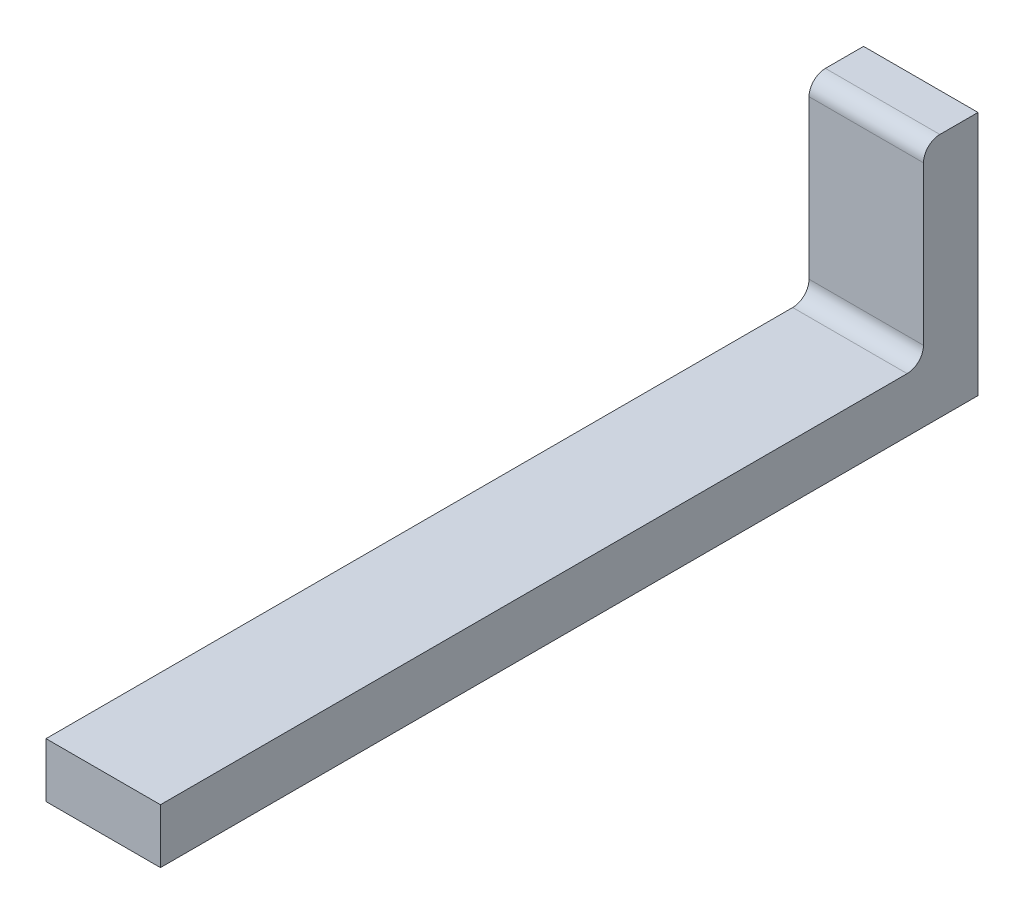
from build123d import *

# Parameters (mm, degrees)
SKETCH1_W                = 82
SKETCH1_H                = 150
BOSS_EXTRUDE1_DEPTH      = 10
SKETCH2_W                = 10
SKETCH2_H                = 45
BOSS_EXTRUDE2_DEPTH      = 82
BOSS_EXTRUDE3_DEPTH      = 42
BOSS_EXTRUDE3_DEPTH_BACK = 10
FILLET3_RADIUS           = 26
FILLET3_LENGTH           = 10
FILLET4_RADIUS           = 26
FILLET4_LENGTH           = 10
BOSS_EXTRUDE4_DEPTH      = 10
BOSS_EXTRUDE5_DEPTH      = 10
FILLET5_R                = 15
FILLET6_R                = 15
SKETCH6_R                = 8
SKETCH6_R_2              = 5.5
CUT_EXTRUDE1_DEPTH       = 131.057679512
FILLET7_R                = 3
FILLET8_R                = 3
FILLET9_R                = 3
FILLET10_R               = 3
FILLET11_R               = 2
SKETCH7_R                = 5.5
CUT_EXTRUDE2_DEPTH       = 116.043470045
SKETCH8_W                = 182.93165677
SKETCH8_H                = 103.574339271
CUT_EXTRUDE3_DEPTH       = 131.057679512
SKETCH9_W                = 12.711196948
SKETCH9_H                = 88.540061501
BOSS_EXTRUDE6_DEPTH      = 10


with BuildPart() as part:
    # Sketch1 → Boss-Extrude1 (new body)
    with BuildSketch(Plane(origin=(0, 0, 0), x_dir=(1, 0, 0), z_dir=(0, 1, 0))):
        Rectangle(SKETCH1_W, SKETCH1_H)
    extrude(amount=BOSS_EXTRUDE1_DEPTH)

    # Sketch2 → Boss-Extrude2 (add, through all)
    with BuildSketch(Plane(origin=(41, 0, 0), x_dir=(0, 0, -1), z_dir=(1, 0, 0))):
        with Locations((70, 22.5)):
            Rectangle(SKETCH2_W, SKETCH2_H)
    extrude(amount=-BOSS_EXTRUDE2_DEPTH)

    # Sketch3 → Boss-Extrude3 (add, two sides: drawn at the far end of the back side and taken through both)
    with BuildSketch(Plane.XY.offset(-65).offset(-BOSS_EXTRUDE3_DEPTH_BACK)):
        Polygon((10, 45), (10, 10), (20, 10), (20, 45), (20, 87), (10, 87), align=None)
        Polygon((-10, 45), (-10, 87), (-20, 87), (-20, 45), (-20, 10), (-10, 10), align=None)
    extrude(amount=BOSS_EXTRUDE3_DEPTH + BOSS_EXTRUDE3_DEPTH_BACK)

    # Fillet3: full round fillet: the end face becomes a half cylinder, R = half its width
    fillet3_face = Plane((15, 87, -49), x_dir=(-1, 0, 0), z_dir=(0, 1, 0))  # on the end face: x along it, z out of the body
    fillet3_slab = fillet3_face.offset(-FILLET3_RADIUS / 2) * Box(FILLET3_LENGTH, 2 * FILLET3_RADIUS, FILLET3_RADIUS, mode=Mode.PRIVATE)  # the body's end, R deep
    fillet3_round = Plane((15, 61, -49), x_dir=(0, 1, 0), z_dir=(-1, 0, 0)) * Cylinder(FILLET3_RADIUS, FILLET3_LENGTH, mode=Mode.PRIVATE)  # its axis R under the face
    add(fillet3_slab - fillet3_round, mode=Mode.SUBTRACT)

    # Fillet4: full round fillet: the end face becomes a half cylinder, R = half its width
    fillet4_face = Plane((-15, 87, -49), x_dir=(-1, 0, 0), z_dir=(0, 1, 0))  # on the end face: x along it, z out of the body
    fillet4_slab = fillet4_face.offset(-FILLET4_RADIUS / 2) * Box(FILLET4_LENGTH, 2 * FILLET4_RADIUS, FILLET4_RADIUS, mode=Mode.PRIVATE)  # the body's end, R deep
    fillet4_round = Plane((-15, 61, -49), x_dir=(0, 1, 0), z_dir=(-1, 0, 0)) * Cylinder(FILLET4_RADIUS, FILLET4_LENGTH, mode=Mode.PRIVATE)  # its axis R under the face
    add(fillet4_slab - fillet4_round, mode=Mode.SUBTRACT)

    # Sketch4 → Boss-Extrude4 (add)
    with BuildSketch(Plane(origin=(20, 0, 0), x_dir=(0, 0, -1), z_dir=(1, 0, 0))):
        Polygon((23, 10), (23, 50), (-75, 25), (-75, 10), align=None)
    extrude(amount=-BOSS_EXTRUDE4_DEPTH)

    # Sketch5 → Boss-Extrude5 (add)
    with BuildSketch(Plane.ZY.offset(20)):
        Polygon((-23, 50), (75, 25), (75, 10), (-23, 10), align=None)
    extrude(amount=-BOSS_EXTRUDE5_DEPTH)

    # Fillet5
    fillet5_edges = [part.edges().sort_by_distance(p)[0] for p in [
        (15, 25, 75),
    ]]
    fillet(fillet5_edges, radius=FILLET5_R)

    # Fillet6
    fillet6_edges = [part.edges().sort_by_distance(p)[0] for p in [
        (-15, 25, 75),
    ]]
    fillet(fillet6_edges, radius=FILLET6_R)

    # Sketch6 → Cut-Extrude1 (cut, through all)
    with BuildSketch(Plane(origin=(20, 0, 0), x_dir=(0, 0, -1), z_dir=(1, 0, 0))):
        with Locations((49, 61)):
            Circle(SKETCH6_R)
        with Locations((-60, 17.5)):
            Circle(SKETCH6_R_2)
    extrude(amount=-CUT_EXTRUDE1_DEPTH, mode=Mode.SUBTRACT)

    # Fillet7
    fillet7_edges = [part.edges().sort_by_distance(p)[0] for p in [
        (30.5, 45, -65),
    ]]
    fillet(fillet7_edges, radius=FILLET7_R)

    # Fillet8
    fillet8_edges = [part.edges().sort_by_distance(p)[0] for p in [
        (0, 45, -65),
    ]]
    fillet(fillet8_edges, radius=FILLET8_R)

    # Fillet9
    fillet9_edges = [part.edges().sort_by_distance(p)[0] for p in [
        (-30.5, 45, -65),
    ]]
    fillet(fillet9_edges, radius=FILLET9_R)

    # Fillet10
    fillet10_edges = [part.edges().sort_by_distance(p)[0] for p in [
        (30.5, 10, -65),
        (0, 10, -65),
        (-30.5, 10, -65),
    ]]
    fillet(fillet10_edges, radius=FILLET10_R)

    # Fillet11
    fillet11_edges = [part.edges().sort_by_distance(p)[0] for p in [
        (15, 50, -23),
        (-15, 50, -23),
    ]]
    fillet(fillet11_edges, radius=FILLET11_R)

    # Sketch7 → Cut-Extrude2 (cut, through all)
    with BuildSketch(Plane(origin=(0, 10, 0), x_dir=(1, 0, 0), z_dir=(0, 1, 0))):
        with Locations(Location((31.5, 45, 0), (0, 0, 270))):
            Circle(SKETCH7_R)
        with Locations(Location((31.5, -15, 0), (0, 0, 270))):
            Circle(SKETCH7_R)
        with Locations(Location((-31.5, -15, 0), (0, 0, 90))):
            Circle(SKETCH7_R)
        with Locations(Location((-31.5, 45, 0), (0, 0, 90))):
            Circle(SKETCH7_R)
    extrude(amount=-CUT_EXTRUDE2_DEPTH, mode=Mode.SUBTRACT)

    # Sketch8 → Cut-Extrude3 (cut, through all)
    with BuildSketch(Plane.ZY.offset(20)):
        with Locations((0.186284783, 47.287847829)):
            Rectangle(SKETCH8_W, SKETCH8_H)
    extrude(amount=-CUT_EXTRUDE3_DEPTH, mode=Mode.SUBTRACT)

    # Sketch9 → Boss-Extrude6 (add, through all)
    with BuildSketch(Plane(origin=(0, 10, 0), x_dir=(1, 0, 0), z_dir=(0, 1, 0))):
        with Locations((-31.157475704, 8.108867018)):
            Rectangle(SKETCH9_W, SKETCH9_H)
    extrude(amount=-BOSS_EXTRUDE6_DEPTH)


solid = part.part
